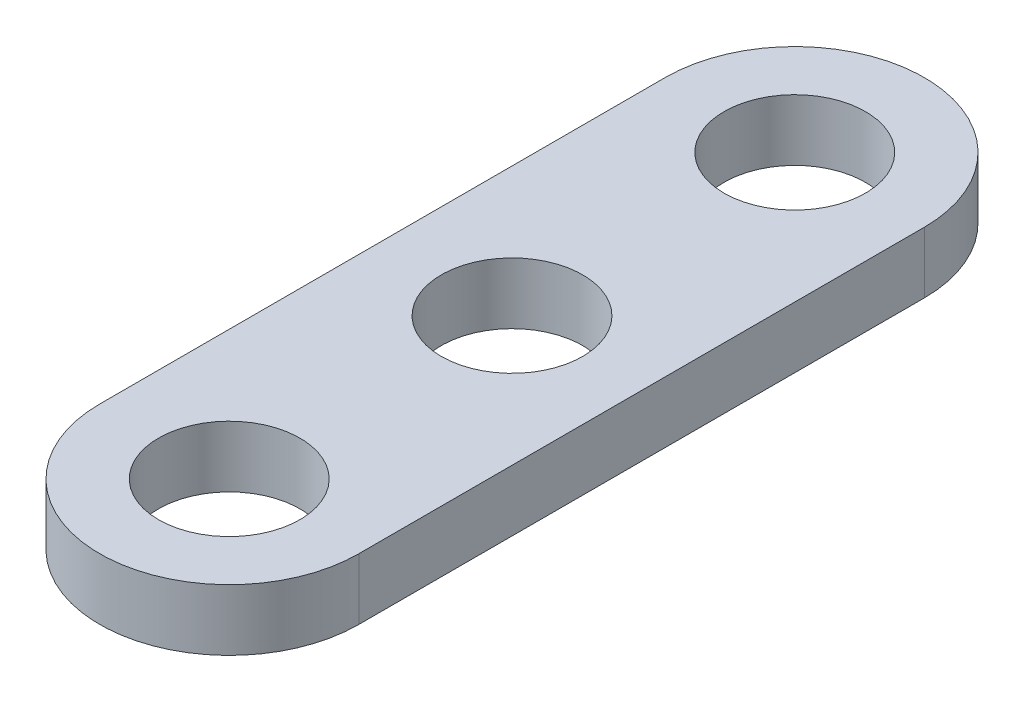
from build123d import *

# Parameters (mm, degrees)
SKETCH_1_R      = 3
EXTRUDE_2_DEPTH = 2.6


with BuildPart() as part:
    # 草图1 → 凸台-拉伸2 (new body)
    with BuildSketch(Plane(origin=(0, 0, 0), x_dir=(1, 0, 0), z_dir=(0, 1, 0))):
        with BuildLine():
            Line((-5.5, -12), (-5.5, 12))
            ThreePointArc((-5.5, 12), (0, 17.5), (5.5, 12))
            Line((5.5, 12), (5.5, -12))
            ThreePointArc((5.5, -12), (0, -17.5), (-5.5, -12))
        make_face()
        with Locations(Location((0, 12, 0), (0, 0, 270))):
            Circle(SKETCH_1_R, mode=Mode.SUBTRACT)
        with Locations(Location((0, -12, 0), (0, 0, 270))):
            Circle(SKETCH_1_R, mode=Mode.SUBTRACT)
        with Locations(Location((0, 0, 0), (0, 0, 270))):
            Circle(SKETCH_1_R, mode=Mode.SUBTRACT)
    extrude(amount=EXTRUDE_2_DEPTH)


solid = part.part
